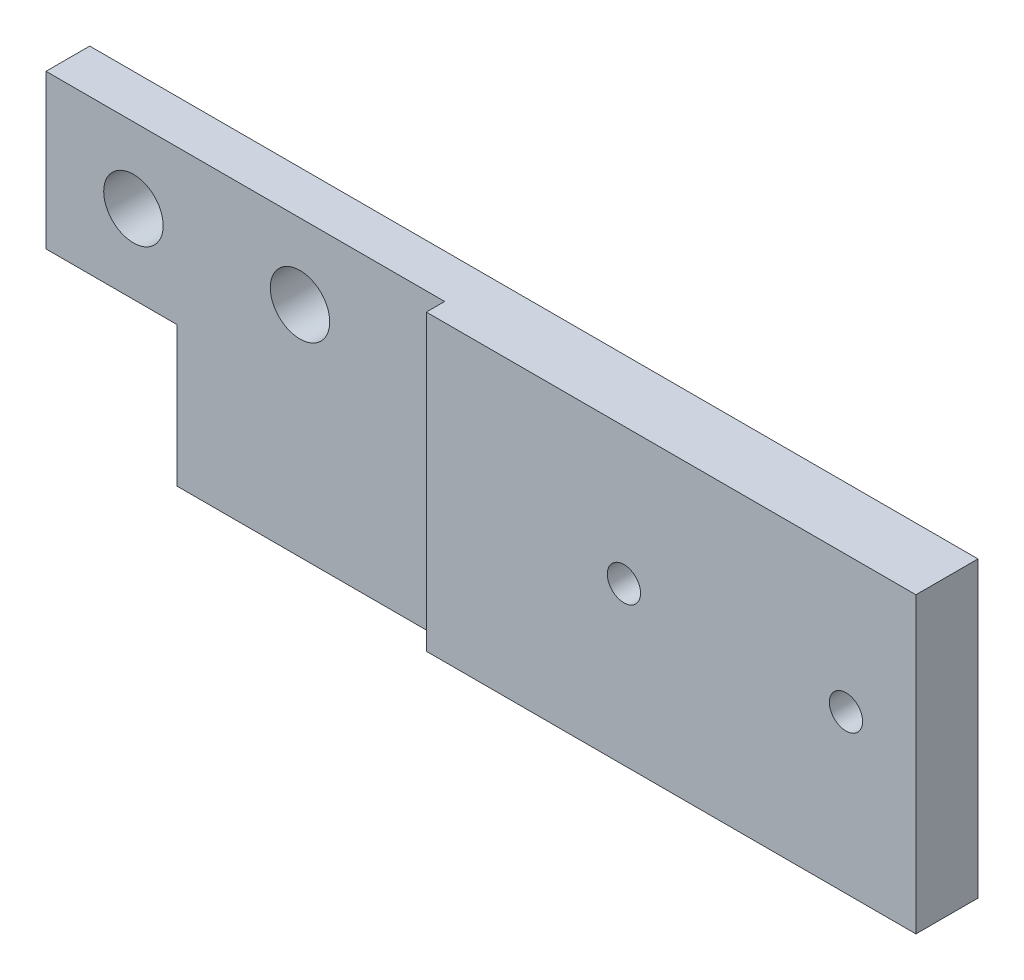
from build123d import *

# Parameters (mm, degrees)
SKETCH1_W           = 101.6
SKETCH1_H           = 33.59912
BOSS_EXTRUDE1_DEPTH = 5
SKETCH2_R           = 3.4
SKETCH2_R_2         = 1.9
CUT_EXTRUDE1_DEPTH  = 5
SKETCH5_W           = 15
SKETCH5_H           = 16
CUT_EXTRUDE4_DEPTH  = 5
SKETCH7_W           = 56
SKETCH7_H           = 33.59912
SKETCH7_R           = 1.9
BOSS_EXTRUDE2_DEPTH = 2.1


with BuildPart() as part:
    # Sketch1 → Boss-Extrude1 (new body)
    with BuildSketch(Plane.XY):
        Rectangle(SKETCH1_W, SKETCH1_H)
    extrude(amount=BOSS_EXTRUDE1_DEPTH)

    # Sketch2 → Cut-Extrude1 (cut)
    with BuildSketch(Plane(origin=(0, 0, 0), x_dir=(-1, 0, 0), z_dir=(0, 0, -1))):
        with Locations((40.8, 8.20044)):
            Circle(SKETCH2_R)
        with Locations((21.75, 8.20044)):
            Circle(SKETCH2_R)
        with Locations((-17.4, 1.20044)):
            Circle(SKETCH2_R_2)
        with Locations((-42.8, 1.20044)):
            Circle(SKETCH2_R_2)
    extrude(amount=-CUT_EXTRUDE1_DEPTH, mode=Mode.SUBTRACT)

    # Sketch5 → Cut-Extrude4 (cut)
    with BuildSketch(Plane(origin=(0, 0, 0), x_dir=(-1, 0, 0), z_dir=(0, 0, -1))):
        with Locations((43.3, -8.79956)):
            Rectangle(SKETCH5_W, SKETCH5_H)
    extrude(amount=-CUT_EXTRUDE4_DEPTH, mode=Mode.SUBTRACT)

    # Sketch7 → Boss-Extrude2 (add)
    with BuildSketch(Plane.XY.offset(5)):
        with Locations((22.8, 0)):
            Rectangle(SKETCH7_W, SKETCH7_H)
        with Locations(Location((17.4, 1.20044, 0), (0, 0, 180))):
            Circle(SKETCH7_R, mode=Mode.SUBTRACT)
        with Locations(Location((42.8, 1.20044, 0), (0, 0, 180))):
            Circle(SKETCH7_R, mode=Mode.SUBTRACT)
    extrude(amount=BOSS_EXTRUDE2_DEPTH)


solid = part.part
